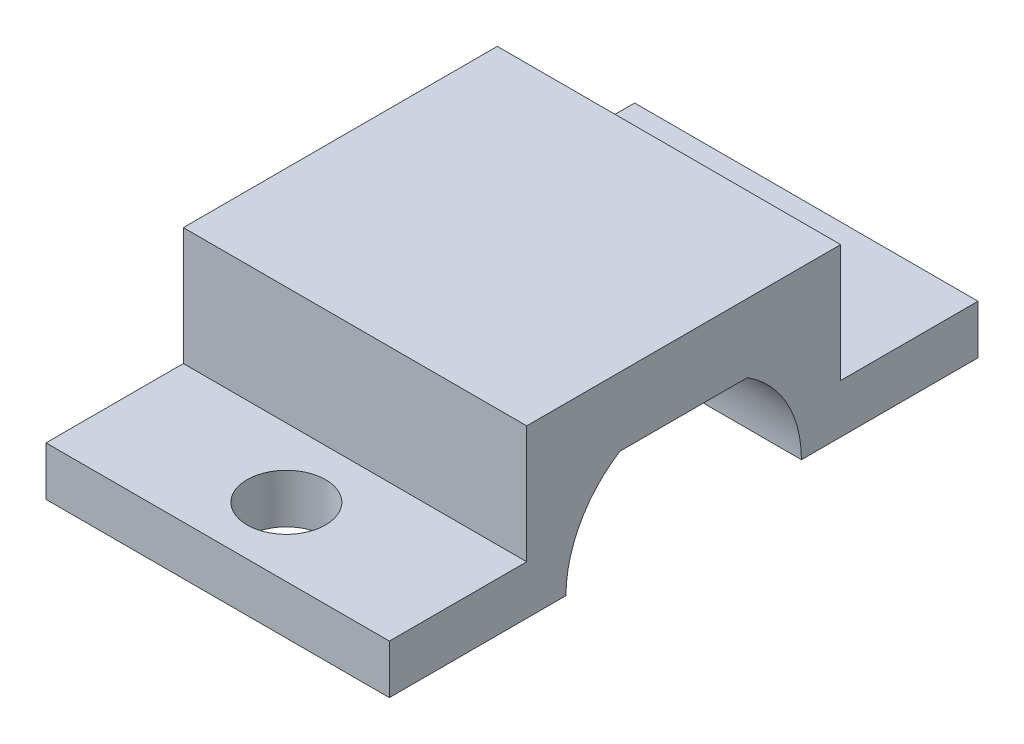
from build123d import *

# Parameters (mm, degrees)
EXTRUDE_1_DEPTH     = 8.75
CUT_EXTRUDE_1_REACH = 20.251
SKETCH_3_R          = 2


with BuildPart() as part:
    # 草圖1 → 填料-伸長1 (new, symmetric)
    with BuildSketch(Plane(origin=(0, 0, 0), x_dir=(0, 0, -1), z_dir=(1, 0, 0))):
        with BuildLine():
            Line((-3.250001327, 2.120345625), (3.250001327, 2.120345625))
            ThreePointArc((3.250001327, 2.120345625), (5.267515394, -0.02636871), (6.00066364, -2.879654375))
            Line((6.00066364, -2.879654375), (15, -2.879654375))
            Line((15, -2.879654375), (15, -0.382935225))
            Line((15, -0.382935225), (8, -0.382935225))
            Line((8, -0.382935225), (8, 5.617064775))
            Line((8, 5.617064775), (-8, 5.617064775))
            Line((-8, 5.617064775), (-8, -0.382935225))
            Line((-8, -0.382935225), (-15, -0.382935225))
            Line((-15, -0.382935225), (-15, -2.879654375))
            Line((-15, -2.879654375), (-5.999788855, -2.879654375))
            ThreePointArc((-5.999788855, -2.879654375), (-5.267080125, -0.026479896), (-3.250001327, 2.120345625))
        make_face()
    extrude(amount=EXTRUDE_1_DEPTH, both=True)

    # 草圖3 → 除料-伸長1 (cut, up to next)
    with BuildSketch(Plane(origin=(0, 0, 0), x_dir=(1, 0, 0), z_dir=(0, 1, 0)), mode=Mode.PRIVATE) as cut_extrude_1_sk1:
        with Locations(Location((0, 11.5, 0), (0, 0, 270))):
            Circle(SKETCH_3_R)
    cut_extrude_1_tool1 = extrude(cut_extrude_1_sk1.sketch, amount=-CUT_EXTRUDE_1_REACH, mode=Mode.PRIVATE) & part.part
    # 草圖3 → 除料-伸長1 (cut, up to next)
    with BuildSketch(Plane(origin=(0, 0, 0), x_dir=(1, 0, 0), z_dir=(0, 1, 0)), mode=Mode.PRIVATE) as cut_extrude_1_sk2:
        with Locations(Location((0, -11.5, 0), (0, 0, 270))):
            Circle(SKETCH_3_R)
    cut_extrude_1_tool2 = extrude(cut_extrude_1_sk2.sketch, amount=-CUT_EXTRUDE_1_REACH, mode=Mode.PRIVATE) & part.part
    add(cut_extrude_1_tool1.solids().sort_by_distance((0, 0, -11.5))[0], mode=Mode.SUBTRACT)
    add(cut_extrude_1_tool2.solids().sort_by_distance((0, 0, 11.5))[0], mode=Mode.SUBTRACT)


solid = part.part
